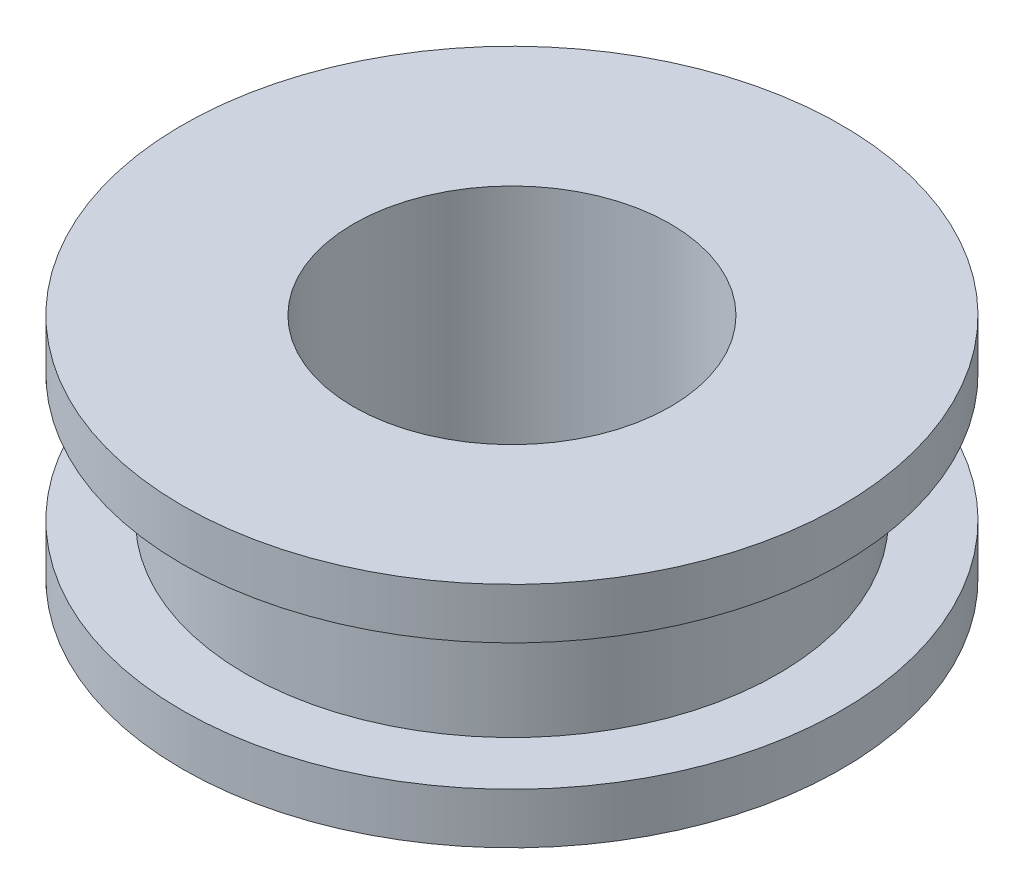
from build123d import *


with BuildPart() as part:
    # Sketch1 → Revolve1 (revolve)
    with BuildSketch(Plane.XY, mode=Mode.PRIVATE) as revolve1_sk:
        Polygon((52, 18), (25, 18), (25, -18), (52, -18), (52, -10), (42, -10), (42, 10), (52, 10), align=None)
    revolve(revolve1_sk.sketch.rotate(Axis((0, 44.394557823, 0), (0, -1, 0)), 90), axis=Axis((0, 44.394557823, 0), (0, -1, 0)))


solid = part.part
